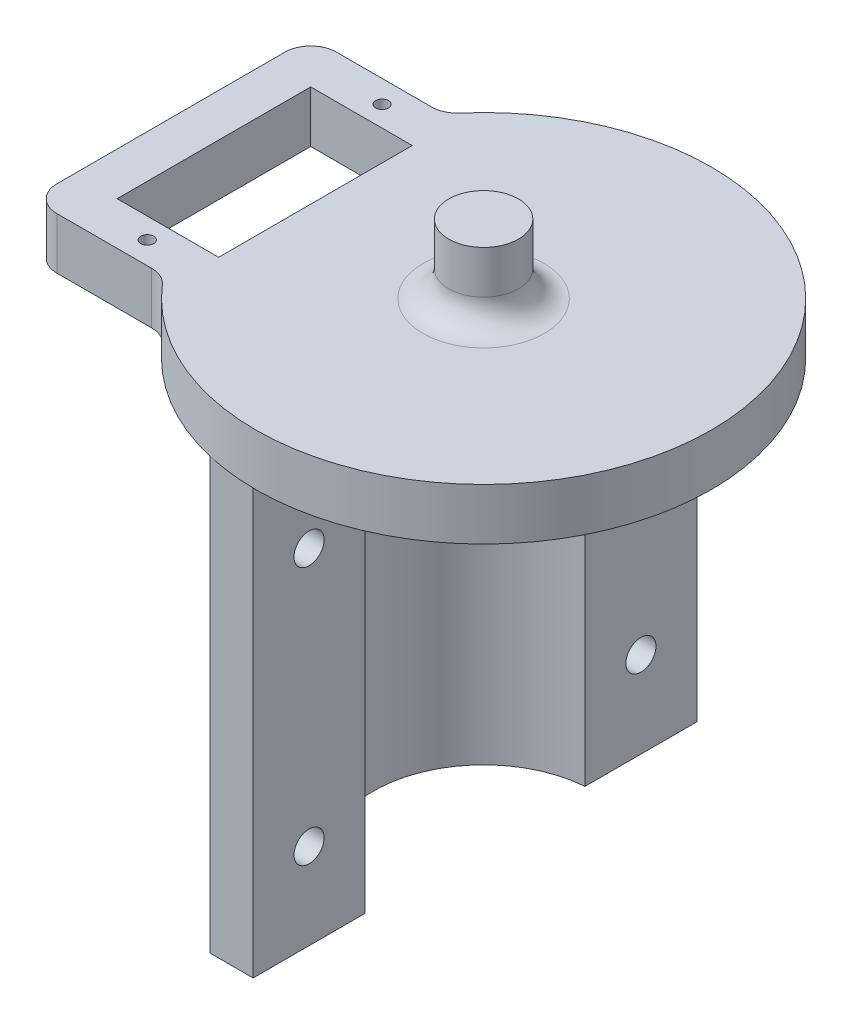
from build123d import *

# Parameters (mm, degrees)
BOSS_EXTRUDE4_DEPTH = 50
SKETCH7_R           = 1.75
CUT_EXTRUDE1_DEPTH  = 59.719147195
SKETCH8_R           = 0.75
SKETCH8_W           = 11.8
SKETCH8_H           = 22.5
BOSS_EXTRUDE5_DEPTH = 6
SKETCH9_R           = 4.05
BOSS_EXTRUDE6_DEPTH = 8
FILLET1_R           = 3


with BuildPart() as part:
    # Sketch6 → Boss-Extrude4 (new body)
    with BuildSketch(Plane.XZ):
        with BuildLine():
            Line((-1, 25.784833184), (-1, 12.785954208))
            ThreePointArc((-1, 12.785954208), (-12.825, 0), (-1, -12.785954208))
            Line((-1, -12.785954208), (-1, -25.784833184))
            Line((-1, -25.784833184), (-6, -25.784833184))
            Line((-6, -25.784833184), (-6, -16.784833184))
            ThreePointArc((-6, -16.784833184), (-17.825, 0), (-6, 16.784833184))
            Line((-6, 16.784833184), (-6, 25.784833184))
            Line((-6, 25.784833184), (-1, 25.784833184))
        make_face()
    extrude(amount=BOSS_EXTRUDE4_DEPTH)

    # Sketch7 → Cut-Extrude1 (cut, through all)
    with BuildSketch(Plane(origin=(-1, 0, 0), x_dir=(0, 0, -1), z_dir=(1, 0, 0))):
        with Locations((-19.285393696, -10)):
            Circle(SKETCH7_R)
        with Locations((-19.285393696, -40)):
            Circle(SKETCH7_R)
        with Locations((19.285393696, -40)):
            Circle(SKETCH7_R)
        with Locations((19.285393696, -10)):
            Circle(SKETCH7_R)
    extrude(amount=-CUT_EXTRUDE1_DEPTH, mode=Mode.SUBTRACT)

    # Sketch8 → Boss-Extrude5 (add)
    with BuildSketch(Plane(origin=(0, 0, 0), x_dir=(1, 0, 0), z_dir=(0, 1, 0))):
        with BuildLine():
            Line((-33.34361413, -16.25), (-22.318992281, -16.25))
            ThreePointArc((-22.318992281, -16.25), (-21.069616181, -16.522536094), (-20.047240136, -17.290627093))
            ThreePointArc((-20.047240136, -17.290627093), (26.473715688, 0), (-20.047240136, 17.290627093))
            ThreePointArc((-20.047240136, 17.290627093), (-21.069616181, 16.522536094), (-22.318992281, 16.25))
            Line((-22.318992281, 16.25), (-33.34361413, 16.25))
            ThreePointArc((-33.34361413, 16.25), (-35.464934474, 15.371320344), (-36.34361413, 13.25))
            Line((-36.34361413, 13.25), (-36.34361413, -13.25))
            ThreePointArc((-36.34361413, -13.25), (-35.464934474, -15.371320344), (-33.34361413, -16.25))
        make_face()
        with Locations(Location((-25.44361413, 13.65, 0), (0, 0, 270))):
            Circle(SKETCH8_R, mode=Mode.SUBTRACT)
        with Locations(Location((-25.44361413, -13.65, 0), (0, 0, 270))):
            Circle(SKETCH8_R, mode=Mode.SUBTRACT)
        with Locations((-25.44361413, 0)):
            Rectangle(SKETCH8_W, SKETCH8_H, mode=Mode.SUBTRACT)
    extrude(amount=BOSS_EXTRUDE5_DEPTH)

    # Sketch9 → Boss-Extrude6 (add)
    with BuildSketch(Plane(origin=(0, 6, 0), x_dir=(1, 0, 0), z_dir=(0, 1, 0))):
        with Locations(Location((0, 0, 0), (0, 0, 270))):
            Circle(SKETCH9_R)
    extrude(amount=BOSS_EXTRUDE6_DEPTH)

    # Fillet1
    fillet1_edges = [part.edges().sort_by_distance(p)[0] for p in [
        (0, 6, -4.05),
    ]]
    fillet(fillet1_edges, radius=FILLET1_R)


solid = part.part
